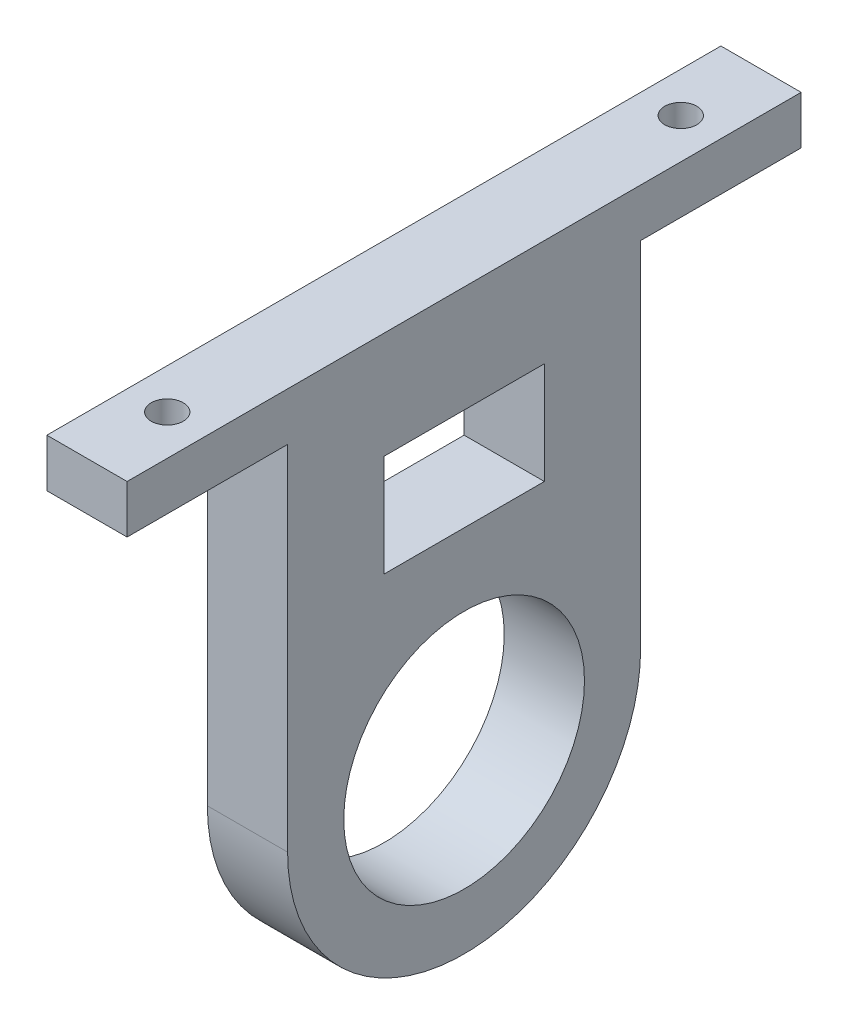
from build123d import *

# Parameters (mm, degrees)
SKETCH1_R           = 11
SKETCH1_R_2         = 7.5
EXTRUDE_THIN1_DEPTH = 5
BOSS_EXTRUDE2_DEPTH = 5
SKETCH4_W           = 5
SKETCH4_H           = 3
BOSS_EXTRUDE3_DEPTH = 10
SKETCH5_R           = 1
CUT_EXTRUDE1_DEPTH  = 5
LPATTERN1_COUNT     = 2
LPATTERN1_PITCH     = 32
SKETCH6_W           = 10
SKETCH6_H           = 6.354024863
CUT_EXTRUDE2_DEPTH  = 5


with BuildPart() as part:
    # Sketch1 → Extrude-Thin1 (new body)
    with BuildSketch(Plane(origin=(0, 0, 0), x_dir=(0, 0, -1), z_dir=(1, 0, 0))):
        Circle(SKETCH1_R)
        Circle(SKETCH1_R_2, mode=Mode.SUBTRACT)
    extrude(amount=EXTRUDE_THIN1_DEPTH)

    # Sketch2 → Boss-Extrude2 (add)
    with BuildSketch(Plane(origin=(0, 0, 0), x_dir=(0, 0, -1), z_dir=(1, 0, 0))):
        with BuildLine():
            Line((-11, 0), (-11, 25))
            Line((-11, 25), (11, 25))
            Line((11, 25), (11, 0))
            ThreePointArc((11, 0), (0, 11), (-11, 0))
        make_face()
    extrude(amount=BOSS_EXTRUDE2_DEPTH)

    # Sketch4 → Boss-Extrude3 (add)
    with BuildSketch(Plane(origin=(0, 0, -11), x_dir=(-1, 0, 0), z_dir=(0, 0, -1))):
        with Locations((-2.5, 23.5)):
            Rectangle(SKETCH4_W, SKETCH4_H)
    boss_extrude3 = extrude(amount=BOSS_EXTRUDE3_DEPTH)

    # Sketch5 → Cut-Extrude1 (cut)
    with BuildSketch(Plane(origin=(0, 25, 0), x_dir=(1, 0, 0), z_dir=(0, 1, 0))):
        with Locations(Location((2.5, 16, 0), (0, 0, 270))):
            Circle(SKETCH5_R)
    cut_extrude1 = extrude(amount=-CUT_EXTRUDE1_DEPTH, mode=Mode.SUBTRACT)

    # LPattern1: Boss-Extrude3, Cut-Extrude1 ×2
    with Locations(*[(0, 0, i * LPATTERN1_PITCH) for i in range(1, LPATTERN1_COUNT)]):
        add(boss_extrude3)
        add(cut_extrude1, mode=Mode.SUBTRACT)

    # Sketch6 → Cut-Extrude2 (cut)
    with BuildSketch(Plane(origin=(5, 0, 0), x_dir=(0, 0, -1), z_dir=(1, 0, 0))):
        with Locations((0, 15.177012432)):
            Rectangle(SKETCH6_W, SKETCH6_H)
    extrude(amount=-CUT_EXTRUDE2_DEPTH, mode=Mode.SUBTRACT)


solid = part.part
